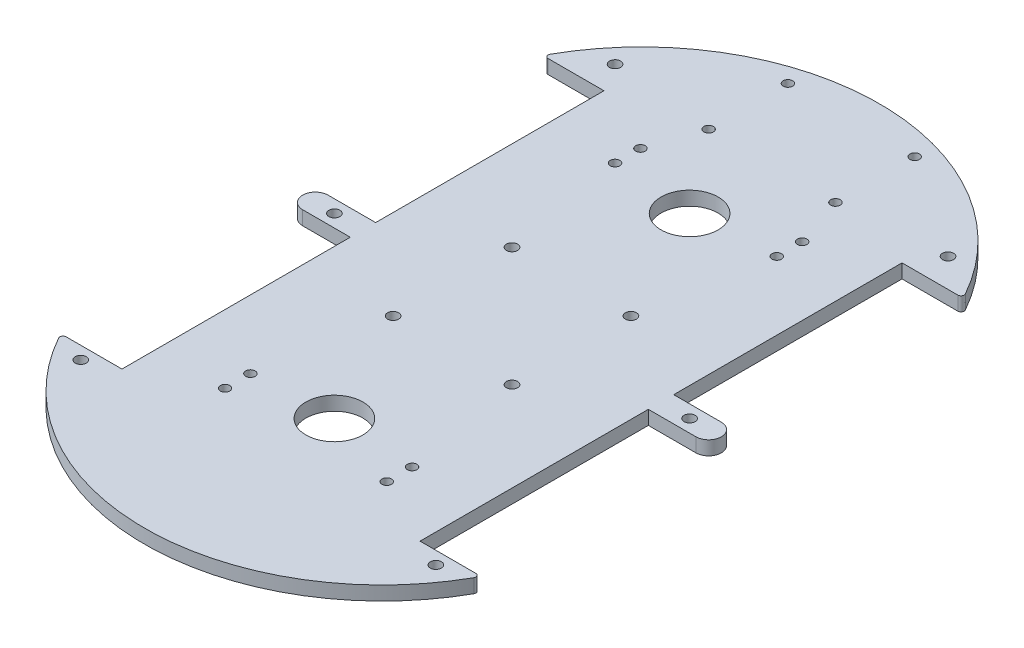
from build123d import *

# Parameters (mm, degrees)
SKETCH2_W                  = 132
SKETCH2_H                  = 232
PLATE_SIZE_DEPTH           = 4.4
SKETCH4_OUTSIDE_W          = 187.392
SKETCH4_OUTSIDE_H          = 287.392
OUTER_PROFILE_DEPTH        = 134.534115491
M3_CLEARANCE_HOLE1_D       = 3.5
F_18_0_18_DIAMETER_HOLE4_D = 18
M3_CLEARANCE_HOLE2_D       = 3.5
M3_CLEARANCE_HOLE3_D       = 3
M3_CLEARANCE_HOLE4_D       = 3


with BuildPart() as part:
    # Sketch2 → Plate Size (new body)
    with BuildSketch(Plane(origin=(0, 0, 0), x_dir=(1, 0, 0), z_dir=(0, 1, 0))):
        Rectangle(SKETCH2_W, SKETCH2_H)
    extrude(amount=PLATE_SIZE_DEPTH)

    # Sketch4 outside → Outer Profile (cut, through all)
    with BuildSketch(Plane(origin=(0, 0, 0), x_dir=(1, 0, 0), z_dir=(0, 1, 0))):
        Rectangle(SKETCH4_OUTSIDE_W, SKETCH4_OUTSIDE_H)
        with BuildLine():
            Line((-64.599996007, 76), (-47, 76))
            Line((-47, 76), (-47, 4))
            Line((-47, 4), (-62, 4))
            ThreePointArc((-62, 4), (-66, 0), (-62, -4))
            Line((-62, -4), (-47, -4))
            Line((-47, -4), (-47, -76))
            Line((-47, -76), (-64.599996007, -76))
            ThreePointArc((-64.599996007, -76), (-65.462483305, -76.493921289), (-65.472968926, -77.487768677))
            ThreePointArc((-65.472968926, -77.487768677), (0, -115.905117871), (65.472968926, -77.487768677))
            ThreePointArc((65.472968926, -77.487768677), (65.462483305, -76.493921289), (64.599996007, -76))
            Line((64.599996007, -76), (47, -76))
            Line((47, -76), (47, -4))
            Line((47, -4), (62, -4))
            ThreePointArc((62, -4), (66, 0), (62, 4))
            Line((62, 4), (47, 4))
            Line((47, 4), (47, 76))
            Line((47, 76), (64.599996007, 76))
            ThreePointArc((64.599996007, 76), (65.462483305, 76.493921289), (65.472968926, 77.487768677))
            ThreePointArc((65.472968926, 77.487768677), (0, 115.905117871), (-65.472968926, 77.487768677))
            ThreePointArc((-65.472968926, 77.487768677), (-65.462483305, 76.493921289), (-64.599996007, 76))
        make_face(mode=Mode.SUBTRACT)
    extrude(amount=OUTER_PROFILE_DEPTH, mode=Mode.SUBTRACT)

    # M3 Clearance Hole1 (through all)
    with Locations(Plane.XZ):
        with Locations((-55.999996141, 80.000001937), (55.999996141, 80.000001937), (-52.5, -85), (52.5, -85), (-55.999996141, 0), (55.999996141, 0)):
            Hole(M3_CLEARANCE_HOLE1_D / 2)

    # Ø18.0 (18) Diameter Hole4 (through all)
    with Locations(Plane.XZ):
        with Locations((0, -56), (0, 56)):
            Hole(F_18_0_18_DIAMETER_HOLE4_D / 2)

    # M3 Clearance Hole2 (through all)
    with Locations(Plane.XZ):
        with Locations((18.75, -18.75), (-18.75, 18.75), (18.75, 18.75), (-18.75, -18.75)):
            Hole(M3_CLEARANCE_HOLE2_D / 2)

    # M3 Clearance Hole3 (through all)
    with Locations(Plane.XZ):
        with Locations((-25.5, -66.00000008), (25.5, 65.00000008), (-25.5, 65.00000008), (25.5, -66.00000008), (-25.5, -58.00000008), (25.5, -58.00000008), (25.5, 57.00000008), (-25.5, 57.00000008)):
            Hole(M3_CLEARANCE_HOLE3_D / 2)

    # M3 Clearance Hole4 (through all)
    with Locations(Plane.XZ):
        with Locations((-20, -107), (20, -107), (-20, -82), (20, -82)):
            Hole(M3_CLEARANCE_HOLE4_D / 2)


solid = part.part
